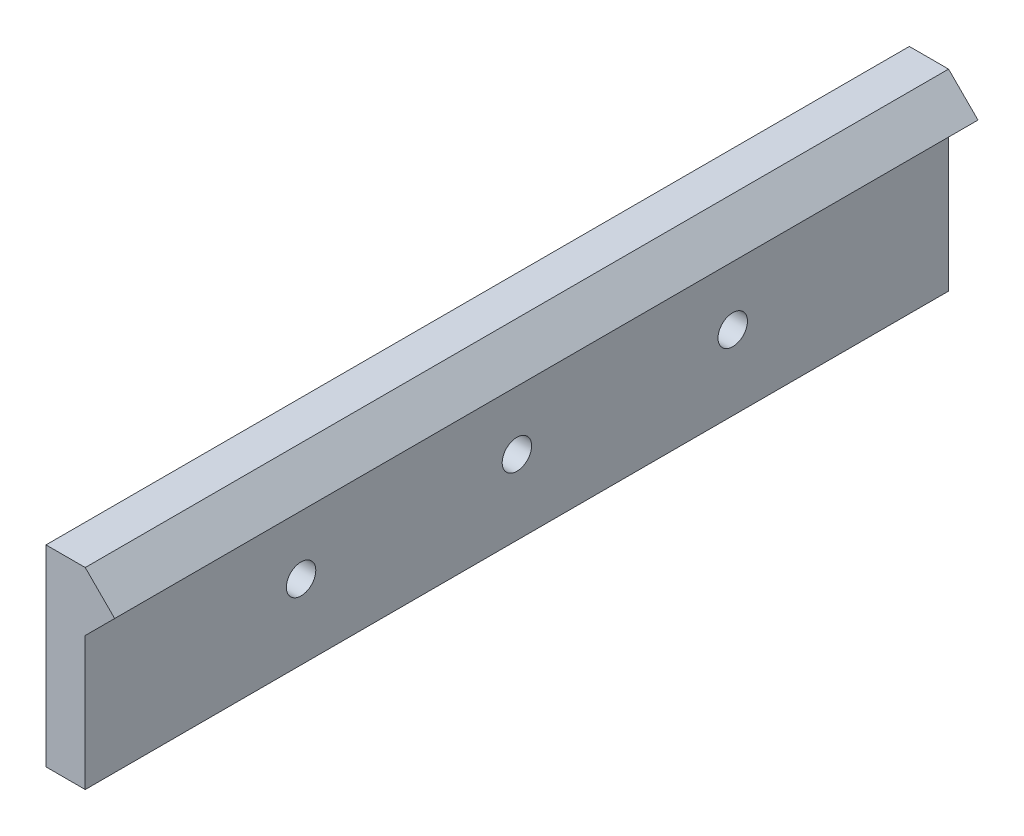
from build123d import *

# Parameters (mm, degrees)
BOSS_EXTRUDE1_DEPTH = 139.7
SKETCH2_R           = 4.7625
CUT_EXTRUDE1_DEPTH  = 38.1


with BuildPart() as part:
    # Sketch1 → Boss-Extrude1 (new, symmetric)
    with BuildSketch(Plane.XY):
        Polygon((6.35, 63.5), (15.875, 53.975), (6.35, 44.45), (6.35, 1.27), (-6.35, 1.27), (-6.35, 63.5), align=None)
    extrude(amount=BOSS_EXTRUDE1_DEPTH, both=True)

    # Sketch2 → Cut-Extrude1 (cut, symmetric)
    with BuildSketch(Plane(origin=(0, 0, 0), x_dir=(0, 0, -1), z_dir=(1, 0, 0))):
        with Locations((-69.85, 25.4)):
            Circle(SKETCH2_R)
        with Locations((0, 25.4)):
            Circle(SKETCH2_R)
        with Locations((69.85, 25.4)):
            Circle(SKETCH2_R)
    extrude(amount=CUT_EXTRUDE1_DEPTH, both=True, mode=Mode.SUBTRACT)


solid = part.part
